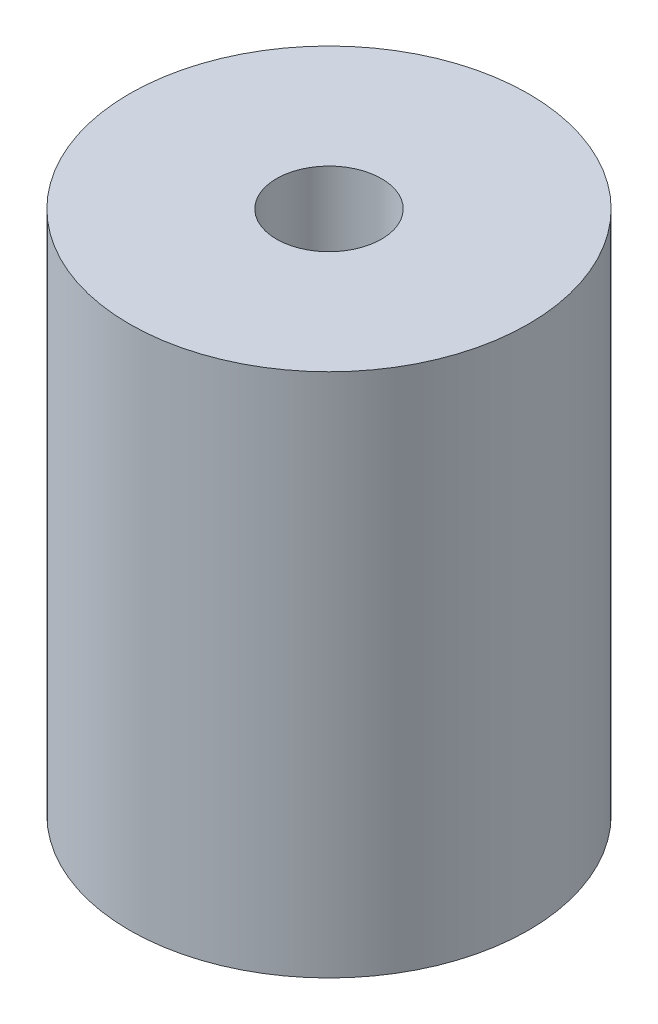
from build123d import *

# Parameters (mm, degrees)
SKETCH1_R           = 9.5
BOSS_EXTRUDE1_DEPTH = 25
SKETCH2_R           = 2.5
CUT_EXTRUDE1_DEPTH  = 12.5
SKETCH3_R           = 4
CUT_EXTRUDE2_DEPTH  = 12.5


with BuildPart() as part:
    # Sketch1 → Boss-Extrude1 (new body)
    with BuildSketch(Plane(origin=(0, 0, 0), x_dir=(1, 0, 0), z_dir=(0, 1, 0))):
        with Locations(Location((0, 0, 0), (0, 0, 270))):
            Circle(SKETCH1_R)
    extrude(amount=BOSS_EXTRUDE1_DEPTH)

    # Sketch2 → Cut-Extrude1 (cut)
    with BuildSketch(Plane(origin=(0, 25, 0), x_dir=(1, 0, 0), z_dir=(0, 1, 0))):
        with Locations(Location((0, 0, 0), (0, 0, 270))):
            Circle(SKETCH2_R)
    extrude(amount=-CUT_EXTRUDE1_DEPTH, mode=Mode.SUBTRACT)

    # Sketch3 → Cut-Extrude2 (cut)
    with BuildSketch(Plane.XZ):
        with Locations(Location((0, 0, 0), (0, 0, 270))):
            Circle(SKETCH3_R)
    extrude(amount=-CUT_EXTRUDE2_DEPTH, mode=Mode.SUBTRACT)


solid = part.part
